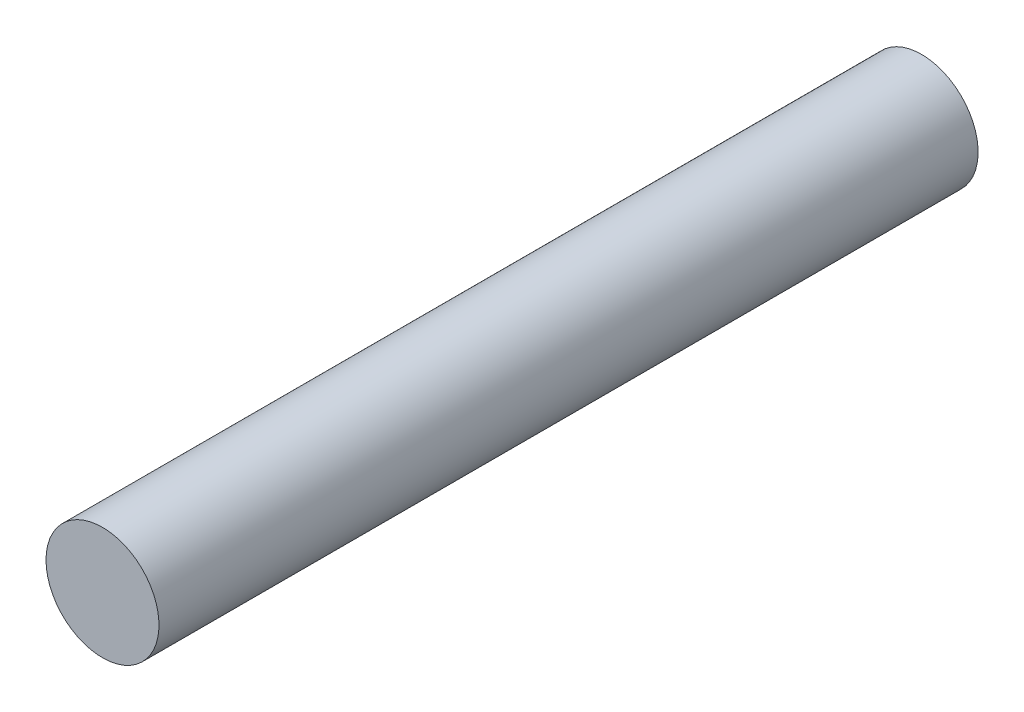
from build123d import *

# Parameters (mm, degrees)
SKETCH1_R           = 4
BOSS_EXTRUDE1_DEPTH = 29


with BuildPart() as part:
    # Sketch1 → Boss-Extrude1 (new, symmetric)
    with BuildSketch(Plane.XY):
        with Locations(Location((0, 0, 0), (0, 0, 180))):
            Circle(SKETCH1_R)
    extrude(amount=BOSS_EXTRUDE1_DEPTH, both=True)


solid = part.part
